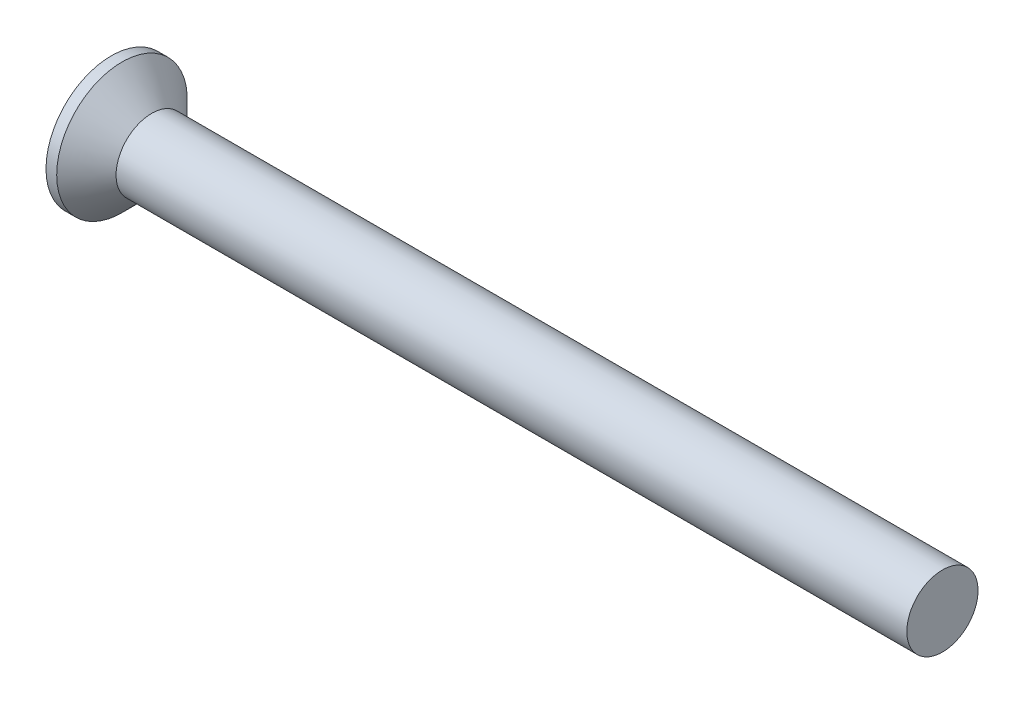
from build123d import *

# Parameters (mm, degrees)
CIRPATTERN1_COUNT = 2
CIRPATTERN1_ANGLE = 90


with BuildPart() as part:
    # BodySke → Base-Revolve (revolve)
    with BuildSketch(Plane.XY, mode=Mode.PRIVATE) as base_revolve_sk:
        Polygon((0, 0), (0, 2.75), (0.45, 2.75), (1.7, 1.5), (35, 1.5), (35, 0), align=None)
    revolve(base_revolve_sk.sketch.rotate(Axis((-6.35, 0, 0), (1, 0, 0)), 90), axis=Axis((-6.35, 0, 0), (1, 0, 0)))

    # Sketch3 → Cross section 0
    with BuildSketch(Plane.ZY):
        with BuildLine():
            Line((-0.395, 1.55), (0.395, 1.55))
            Line((0.395, 1.55), (0.395, -1.55))
            Line((0.395, -1.55), (-0.395, -1.55))
            Line((-0.395, -1.55), (-0.395, 1.55))
        make_face()
    # Sketch4 → Cross section 1
    with BuildSketch(Plane.ZY.offset(-2.08)):
        with BuildLine():
            Line((-0.1975, 0.1975), (0.1975, 0.1975))
            Line((0.1975, 0.1975), (0.1975, -0.1975))
            Line((0.1975, -0.1975), (-0.1975, -0.1975))
            Line((-0.1975, -0.1975), (-0.1975, 0.1975))
        make_face()
    cross = loft(mode=Mode.SUBTRACT)

    # CirPattern1: Cross ×2 about axis
    cirpattern1_axis = Axis((0, 0, 0), (1, 0, 0))
    for i in range(1, CIRPATTERN1_COUNT):
        add(cross.rotate(cirpattern1_axis, i * CIRPATTERN1_ANGLE / (CIRPATTERN1_COUNT - 1)), mode=Mode.SUBTRACT)


solid = part.part
